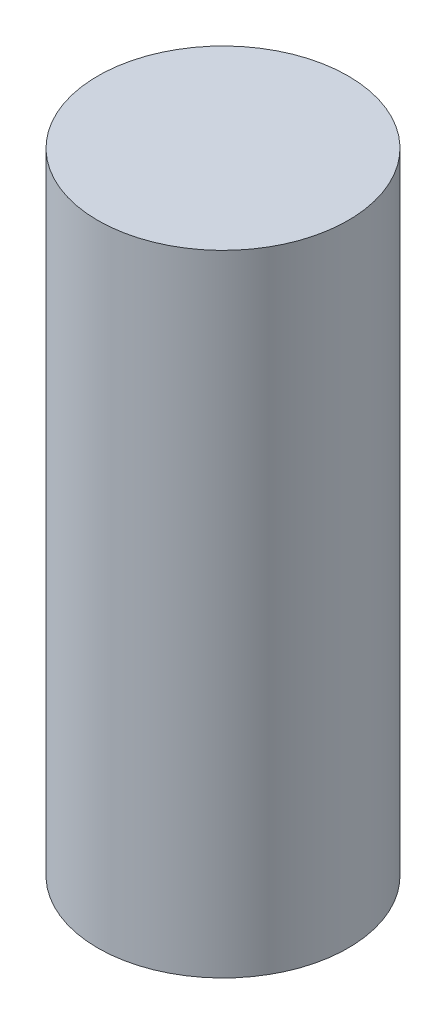
from build123d import *

# Parameters (mm, degrees)
SZKIC1_R                    = 2.225
DODANIE_WYCI_GNI_CIE1_DEPTH = 11.2


with BuildPart() as part:
    # Szkic1 → Dodanie-wyciągnięcie1 (new body)
    with BuildSketch(Plane(origin=(0, 0, 0), x_dir=(1, 0, 0), z_dir=(0, 1, 0))):
        with Locations(Location((0, 0, 0), (0, 0, 270))):
            Circle(SZKIC1_R)
    extrude(amount=DODANIE_WYCI_GNI_CIE1_DEPTH)


solid = part.part
